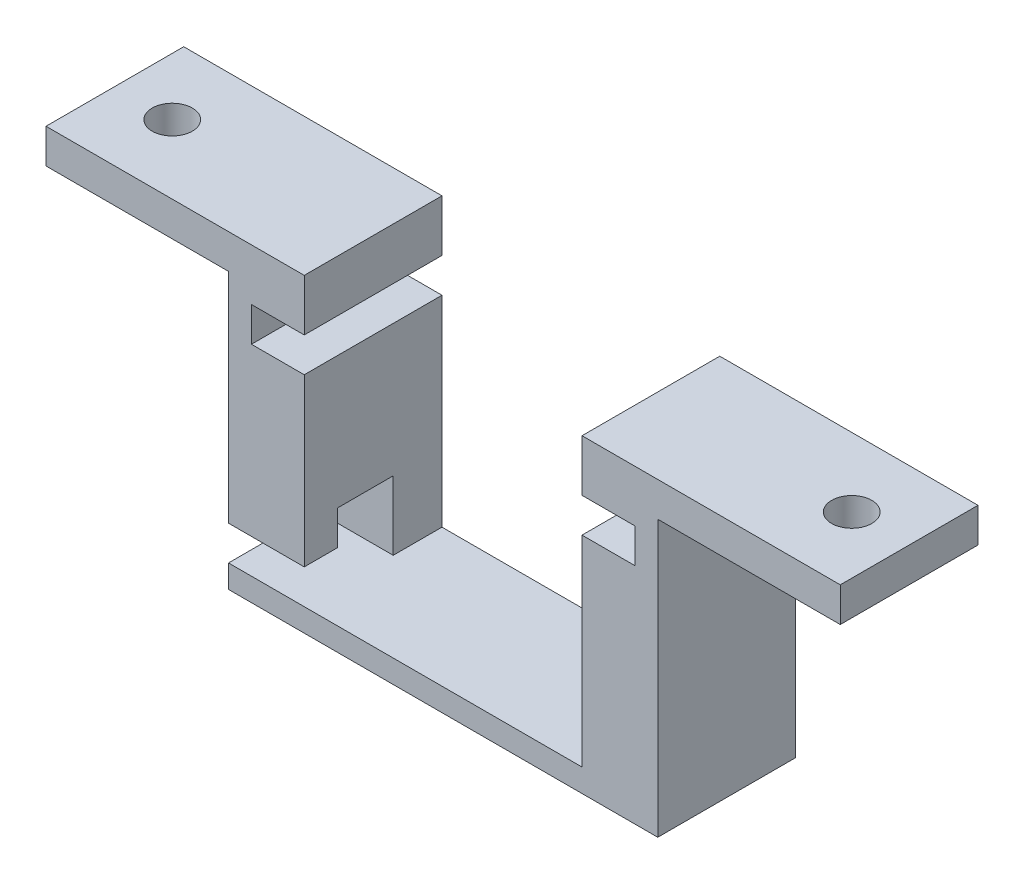
from build123d import *

# Parameters (mm, degrees)
SALIENTE_EXTRUIR1_DEPTH = 12
CORTAR_EXTRUIR1_DEPTH   = 8
CROQUIS4_W              = 6.6
CROQUIS4_H              = 2.892350448
SALIENTE_EXTRUIR3_DEPTH = 3
CROQUIS2_W              = 22.5
CROQUIS2_H              = 12
CROQUIS2_R              = 1.75
SALIENTE_EXTRUIR4_DEPTH = 3


with BuildPart() as part:
    # Croquis1 → Saliente-Extruir1 (new body)
    with BuildSketch(Plane.XY):
        Polygon((-12.1, 0), (12.1, 0), (12.1, 17.5), (16.7, 17.5), (16.7, 20.5), (12.1, 20.5), (12.1, 25), (18.7, 25), (18.7, -2), (-18.7, -2), (-18.7, 25), (-12.1, 25), (-12.1, 20.5), (-16.7, 20.5), (-16.7, 17.5), (-12.1, 17.5), align=None)
    extrude(amount=SALIENTE_EXTRUIR1_DEPTH)

    # Croquis3 → Cortar-Extruir1 (cut)
    with BuildSketch(Plane(origin=(-12.1, 0, 0), x_dir=(0, 0, -1), z_dir=(1, 0, 0))):
        Polygon((-4.25, 0), (-7.75, 0), (-12, 0), (-12, 6), (-7.75, 6), (-4.25, 6), align=None)
    extrude(amount=-CORTAR_EXTRUIR1_DEPTH, mode=Mode.SUBTRACT)

    # Croquis4 → Saliente-Extruir3 (add)
    with BuildSketch(Plane.XZ.offset(-6)):
        with Locations((-15.4, 10.553824776)):
            Rectangle(CROQUIS4_W, CROQUIS4_H)
    extrude(amount=SALIENTE_EXTRUIR3_DEPTH)

    # Croquis2 → Saliente-Extruir4 (add)
    # profile 1 of 2: a face of its own
    with BuildSketch(Plane(origin=(0, 25, 0), x_dir=(1, 0, 0), z_dir=(0, 1, 0))):
        with Locations((-23.35, -6)):
            Rectangle(CROQUIS2_W, CROQUIS2_H)
        with Locations(Location((-29.6, -6, 0), (0, 0, 180))):
            Circle(CROQUIS2_R, mode=Mode.SUBTRACT)
    # profile 2 of 2: a face of its own
    with BuildSketch(Plane(origin=(0, 25, 0), x_dir=(1, 0, 0), z_dir=(0, 1, 0))):
        with Locations((23.35, -6)):
            Rectangle(CROQUIS2_W, CROQUIS2_H)
        with Locations(Location((29.6, -6, 0), (0, 0, 180))):
            Circle(CROQUIS2_R, mode=Mode.SUBTRACT)
    extrude(amount=-SALIENTE_EXTRUIR4_DEPTH)


solid = part.part
